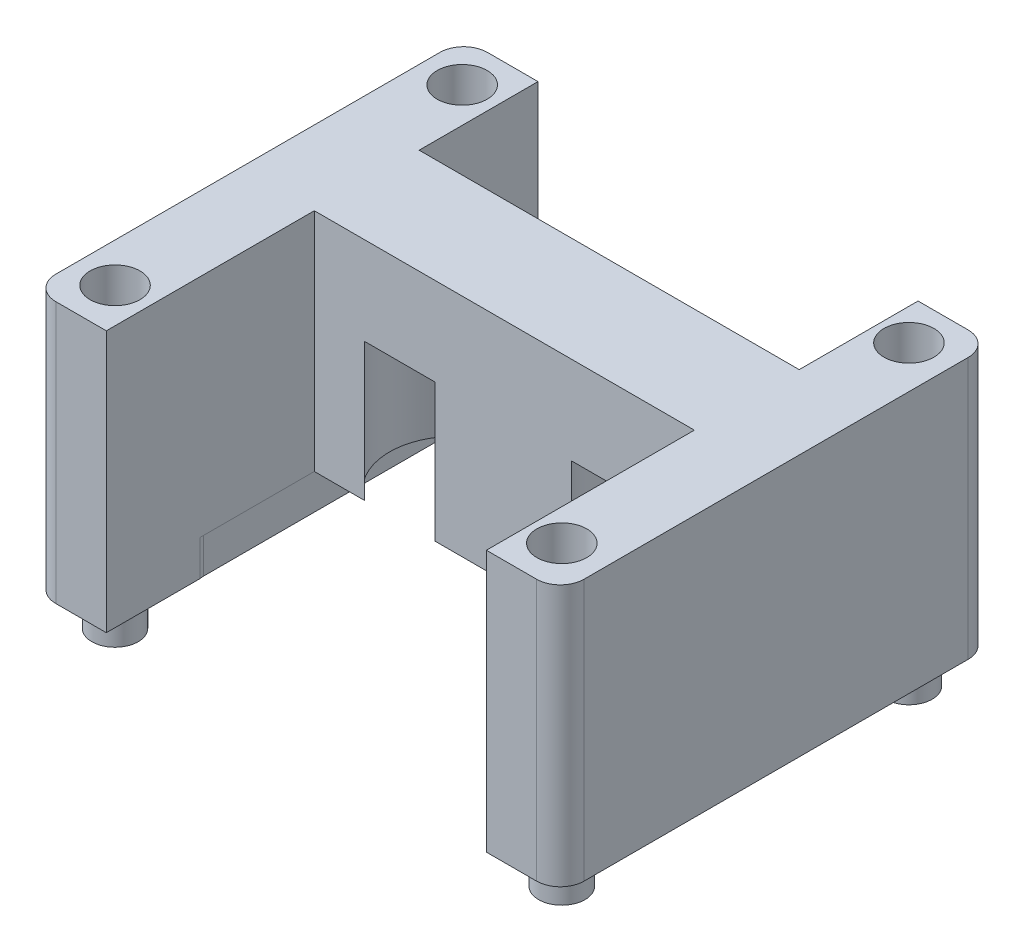
from build123d import *

# Parameters (mm, degrees)
SKETCH_1_W          = 44.45
SKETCH_1_H          = 36.32
EXTRUDE_1_DEPTH     = 22
SKETCH_2_R          = 2.1
SKETCH_2_R_2        = 1
CUT_EXTRUDE_1_DEPTH = 3
FILLET_2_R          = 2
SKETCH_5_W          = 32.01
SKETCH_5_H          = 23.88
CUT_EXTRUDE_2_DEPTH = 3
FILLET_3_R          = 2
SKETCH_6_R          = 5.461
CUT_EXTRUDE_3_DEPTH = 11.5942
SKETCH_7_R          = 1.95
EXTRUDE_2_DEPTH     = 3
EXTRUDE_2_2_DEPTH   = 3
EXTRUDE_2_3_DEPTH   = 3
EXTRUDE_2_4_DEPTH   = 3
SKETCH_8_W          = 31.977593618
SKETCH_8_H          = 17.5
SKETCH_8_H_2        = 10
CUT_EXTRUDE_4_DEPTH = 62.473123396


with BuildPart() as part:
    # Эскиз1 → Бобышка-Вытянуть1 (new body)
    with BuildSketch(Plane(origin=(0, 0, 0), x_dir=(1, 0, 0), z_dir=(0, 1, 0))):
        with Locations((22.225, 18.16)):
            Rectangle(SKETCH_1_W, SKETCH_1_H)
    extrude(amount=EXTRUDE_1_DEPTH)

    # Эскиз2 → Вырез-Вытянуть1 (cut)
    with BuildSketch(Plane(origin=(0, 22, 0), x_dir=(1, 0, 0), z_dir=(0, 1, 0))):
        with Locations(Location((3.302, 32.891, 0), (0, 0, 270))):
            Circle(SKETCH_2_R)
        with Locations(Location((40.894, 32.89, 0), (0, 0, 270))):
            Circle(SKETCH_2_R)
        with Locations(Location((40.894, 3.683, 0), (0, 0, 270))):
            Circle(SKETCH_2_R)
        with Locations(Location((3.302, 3.683, 0), (0, 0, 270))):
            Circle(SKETCH_2_R)
        with Locations((22.225, 36.32)):
            Circle(SKETCH_2_R_2)
    extrude(amount=-CUT_EXTRUDE_1_DEPTH, mode=Mode.SUBTRACT)

    # Скругление2
    fillet_2_edges = [part.edges().sort_by_distance(p)[0] for p in [
        (0, 11, -36.32),
        (44.45, 11, -36.32),
        (44.45, 11, 0),
        (0, 11, 0),
    ]]
    fillet(fillet_2_edges, radius=FILLET_2_R)

    # Эскиз5 → Вырез-Вытянуть2 (cut)
    with BuildSketch(Plane.XZ):
        with Locations((22.225, -18.16)):
            Rectangle(SKETCH_5_W, SKETCH_5_H)
    extrude(amount=-CUT_EXTRUDE_2_DEPTH, mode=Mode.SUBTRACT)

    # Скругление3
    fillet_3_edges = [part.edges().sort_by_distance(p)[0] for p in [
        (6.22, 1.5, -30.1),
        (6.22, 1.5, -6.22),
        (38.23, 1.5, -6.22),
        (38.23, 1.5, -30.1),
    ]]
    fillet(fillet_3_edges, radius=FILLET_3_R)

    # Эскиз6 → Вырез-Вытянуть3 (cut)
    with BuildSketch(Plane.XZ.offset(-3)):
        with Locations(Location((30.87, -22.09, 0), (0, 0, 270))):
            Circle(SKETCH_6_R)
        with Locations(Location((13.45, -22.09, 0), (0, 0, 270))):
            Circle(SKETCH_6_R)
    extrude(amount=-CUT_EXTRUDE_3_DEPTH, mode=Mode.SUBTRACT)

    # Эскиз8 → Вырез-Вытянуть4 (cut, through all)
    with BuildSketch(Plane.XZ):
        with Locations((22.241203191, -8.75)):
            Rectangle(SKETCH_8_W, SKETCH_8_H)
        with Locations((22.241203191, -31.32)):
            Rectangle(SKETCH_8_W, SKETCH_8_H_2)
    extrude(amount=-CUT_EXTRUDE_4_DEPTH, mode=Mode.SUBTRACT)


with BuildPart() as body_2:
    # Эскиз7 → Бобышка-Вытянуть2 (new body)
    with BuildSketch(Plane.XZ):
        with Locations(Location((3.302, -3.683, 0), (0, 0, 270))):
            Circle(SKETCH_7_R)
    extrude(amount=EXTRUDE_2_DEPTH)


with BuildPart() as body_3:
    # Эскиз7 → Extrude 2 2 (new body)
    with BuildSketch(Plane.XZ):
        with Locations(Location((3.302, -32.891, 0), (0, 0, 270))):
            Circle(SKETCH_7_R)
    extrude(amount=EXTRUDE_2_2_DEPTH)


with BuildPart() as body_4:
    # Эскиз7 → Extrude 2 3 (new body)
    with BuildSketch(Plane.XZ):
        with Locations(Location((40.894, -32.89, 0), (0, 0, 270))):
            Circle(SKETCH_7_R)
    extrude(amount=EXTRUDE_2_3_DEPTH)


with BuildPart() as body_5:
    # Эскиз7 → Extrude 2 4 (new body)
    with BuildSketch(Plane.XZ):
        with Locations(Location((40.894, -3.683, 0), (0, 0, 270))):
            Circle(SKETCH_7_R)
    extrude(amount=EXTRUDE_2_4_DEPTH)


solid = Compound([part.part, body_2.part, body_3.part, body_4.part, body_5.part])
